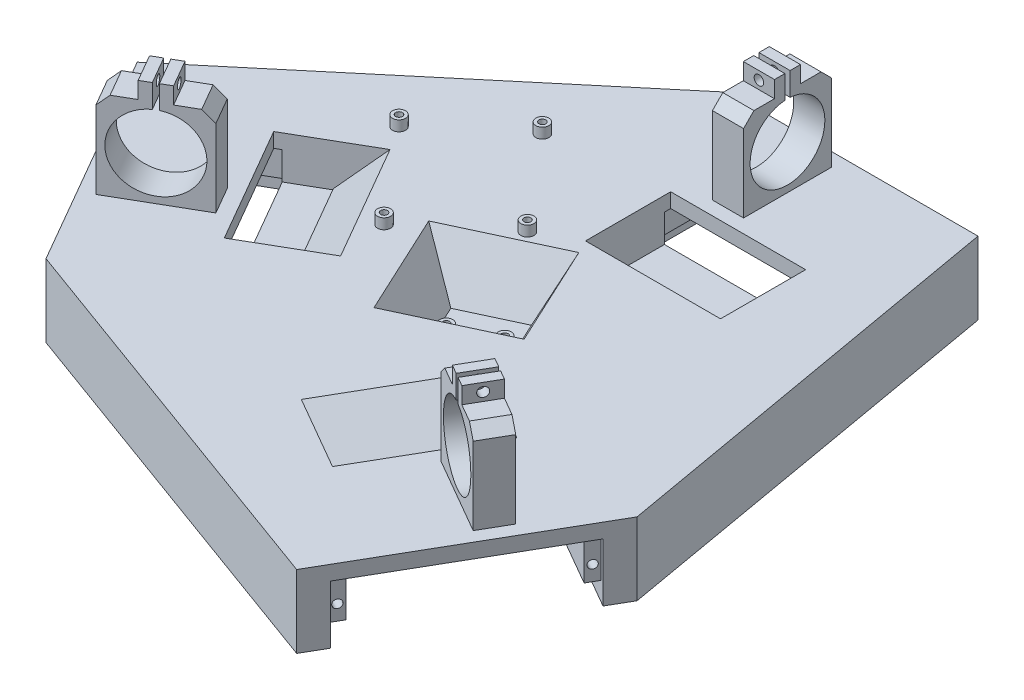
from build123d import *

# Parameters (mm, degrees)
BOSS_EXTRUDE1_DEPTH                     = 35
SKETCH2_W                               = 96
SKETCH2_H                               = 28
CUT_EXTRUDE1_DEPTH                      = 2.5
SKETCH3_W                               = 42
SKETCH3_H                               = 19
CUT_EXTRUDE2_DEPTH                      = 56
SKETCH4_R                               = 2
CUT_EXTRUDE3_DEPTH                      = 6
CUT_EXTRUDE4_START                      = -18
SKETCH5_W                               = 65
SKETCH5_H                               = 22
CUT_EXTRUDE4_DEPTH                      = 21
CHAMFER2_SIZE                           = 20
BOSS_EXTRUDE4_DEPTH                     = 15
CUT_EXTRUDE5_REACH                      = 344.352
SKETCH10_R                              = 2.3
MOTOR_DRIVER_PATTERNED_COUNT            = 3
CHAMFER2_OF_MOTOR_DRIVER_PATTERNED_SIZE = 20
CUT_EXTRUDE6_DEPTH                      = 25
CUT_EXTRUDE6_DRAFT                      = -26.75
SKETCH11_R                              = 3.15
SKETCH11_R_2                            = 1.65
RASPBERRYPI5_STANDOFF_DEPTH             = 5
SKETCH13_R                              = 3.15
SKETCH13_R_2                            = 1.65
BOSS_EXTRUDE6_DEPTH                     = 5


with BuildPart() as part:
    # Sketch1 → Boss-Extrude1 (new body)
    with BuildSketch(Plane(origin=(0, 0, 0), x_dir=(1, 0, 0), z_dir=(0, 1, 0))):
        Polygon((-20, 144.337567297), (100, 144.337567297), (135, -54.848275573), (75, -158.771324027), (-115, -89.489291724), (-175, 14.43375673), align=None)
    extrude(amount=BOSS_EXTRUDE1_DEPTH)

    # Sketch2 → Cut-Extrude1 (cut)
    with BuildSketch(Plane(origin=(0, 0, -144.337567297), x_dir=(-1, 0, 0), z_dir=(0, 0, -1))):
        with Locations((-40, 14)):
            Rectangle(SKETCH2_W, SKETCH2_H)
    cut_extrude1 = extrude(amount=-CUT_EXTRUDE1_DEPTH, mode=Mode.SUBTRACT)

    # Sketch3 → Cut-Extrude2 (cut)
    with BuildSketch(Plane(origin=(0, 0, -141.837567297), x_dir=(-1, 0, 0), z_dir=(0, 0, -1))):
        with Locations((-61, 18.5)):
            Rectangle(SKETCH3_W, SKETCH3_H)
        with Locations((-19, 18.5)):
            Rectangle(SKETCH3_W, SKETCH3_H)
        Polygon((-88, 9), (-88, 0), (8, 0), (8, 9), (2, 9), (-40, 9), (-82, 9), align=None)
    cut_extrude2 = extrude(amount=-CUT_EXTRUDE2_DEPTH, mode=Mode.SUBTRACT)

    # Sketch4 → Cut-Extrude3 (cut)
    with BuildSketch(Plane(origin=(0, 0, -141.837567297), x_dir=(-1, 0, 0), z_dir=(0, 0, -1))):
        with Locations((-85, 16.25)):
            Circle(SKETCH4_R)
        with Locations((5, 16.25)):
            Circle(SKETCH4_R)
    cut_extrude3 = extrude(amount=-CUT_EXTRUDE3_DEPTH, mode=Mode.SUBTRACT)

    # Sketch5 → Cut-Extrude4 (cut)
    with BuildSketch(Plane(origin=(0, 0, -85.837567297), x_dir=(-1, 0, 0), z_dir=(0, 0, -1)).offset(CUT_EXTRUDE4_START)):
        with Locations((-40, 25.5)):
            Rectangle(SKETCH5_W, SKETCH5_H)
    cut_extrude4 = extrude(amount=CUT_EXTRUDE4_DEPTH, mode=Mode.SUBTRACT)

    # Chamfer2
    chamfer2_edges = [part.edges().sort_by_distance(p)[0] for p in [
        (40, 35, -67.837567297),
    ]]
    chamfer(chamfer2_edges, length=CHAMFER2_SIZE)

    # Sketch7 → Boss-Extrude4 (add)
    with BuildSketch(Plane(origin=(36, 0, 0), x_dir=(0, 0, -1), z_dir=(1, 0, 0))):
        with BuildLine():
            Line((95.437567297, 72.3), (95.437567297, 35))
            Line((95.437567297, 35), (137.737567297, 35))
            Line((137.737567297, 35), (137.737567297, 72.3))
            Line((137.737567297, 72.3), (132.737567297, 77.3))
            Line((132.737567297, 77.3), (122.837567297, 77.3))
            Line((122.837567297, 77.3), (122.837567297, 85.3))
            Line((122.837567297, 85.3), (117.837567297, 85.3))
            Line((117.837567297, 85.3), (117.837567297, 74.106544768))
            ThreePointArc((117.837567297, 74.106544768), (116.587567297, 38.15), (115.337567297, 74.106544768))
            Line((115.337567297, 74.106544768), (115.337567297, 85.3))
            Line((115.337567297, 85.3), (110.337567297, 85.3))
            Line((110.337567297, 85.3), (110.337567297, 77.3))
            Line((110.337567297, 77.3), (100.437567297, 77.3))
            Line((100.437567297, 77.3), (95.437567297, 72.3))
        make_face()
    boss_extrude4 = extrude(amount=-BOSS_EXTRUDE4_DEPTH)

    # Cut-Extrude5: up to this face of the body (flat: up to its plane)
    cut_extrude5_end = Plane(part.part.faces().sort_by_distance((28.5, 81.3, -110.337567297))[0])
    # Sketch10 → Cut-Extrude5 (cut, up to the picked face)
    with BuildSketch(Plane(origin=(0, 0, -122.837567297), x_dir=(-1, 0, 0), z_dir=(0, 0, -1)), mode=Mode.PRIVATE) as cut_extrude5_sk1:
        with Locations(Location((-28.5, 81.3, 0), (0, 0, 90))):
            Circle(SKETCH10_R)
    cut_extrude5_tool1 = split(extrude(cut_extrude5_sk1.sketch, amount=-CUT_EXTRUDE5_REACH, mode=Mode.PRIVATE), bisect_by=cut_extrude5_end, keep=Keep.BOTH, mode=Mode.PRIVATE)
    cut_extrude5 = cut_extrude5_tool1.solids().sort_by(Axis((28.5, 81.3, -122.837567), (0, 0, 1)))[0]
    add(cut_extrude5, mode=Mode.SUBTRACT)

    # Motor/Driver Patterned: Cut-Extrude1, Cut-Extrude2, Cut-Extrude3, Cut-Extrude4, Boss-Extrude4, Cut-Extrude5 ×3 about axis
    motor_driver_patterned_axis = Axis((0, 0, 0), (0, 1, 0))
    add([cut_extrude1.rotate(motor_driver_patterned_axis, i * 360 / MOTOR_DRIVER_PATTERNED_COUNT) for i in range(1, MOTOR_DRIVER_PATTERNED_COUNT)], mode=Mode.SUBTRACT)
    add([cut_extrude2.rotate(motor_driver_patterned_axis, i * 360 / MOTOR_DRIVER_PATTERNED_COUNT) for i in range(1, MOTOR_DRIVER_PATTERNED_COUNT)], mode=Mode.SUBTRACT)
    add([cut_extrude3.rotate(motor_driver_patterned_axis, i * 360 / MOTOR_DRIVER_PATTERNED_COUNT) for i in range(1, MOTOR_DRIVER_PATTERNED_COUNT)], mode=Mode.SUBTRACT)
    add([cut_extrude4.rotate(motor_driver_patterned_axis, i * 360 / MOTOR_DRIVER_PATTERNED_COUNT) for i in range(1, MOTOR_DRIVER_PATTERNED_COUNT)], mode=Mode.SUBTRACT)
    add([boss_extrude4.rotate(motor_driver_patterned_axis, i * 360 / MOTOR_DRIVER_PATTERNED_COUNT) for i in range(1, MOTOR_DRIVER_PATTERNED_COUNT)])
    add([cut_extrude5.rotate(motor_driver_patterned_axis, i * 360 / MOTOR_DRIVER_PATTERNED_COUNT) for i in range(1, MOTOR_DRIVER_PATTERNED_COUNT)], mode=Mode.SUBTRACT)

    # Chamfer2 of Motor/Driver Patterned
    chamfer2_of_motor_driver_patterned_edges = [part.edges().sort_by_distance(p)[0] for p in [
        (-78.74905661, 35, -0.722232503),
        (38.74905661, 35, 68.5597998),
    ]]
    chamfer(chamfer2_of_motor_driver_patterned_edges, length=CHAMFER2_OF_MOTOR_DRIVER_PATTERNED_SIZE)


with BuildPart() as cut_extrude6_tool:
    # Sketch16 → Cut-Extrude6 (with draft: the straight prism first)
    with BuildSketch(Plane(origin=(0, 10, 0), x_dir=(1, 0, 0), z_dir=(0, 1, 0))):
        Polygon((4.64219366, 24.61990329), (-21.829310641, 12.295153393), (-9.504560743, -14.176350908), (16.966943558, -1.851601011), align=None)
    extrude(amount=CUT_EXTRUDE6_DEPTH)
    # Cut-Extrude6: the draft: its side faces are tilted about the plane it starts from
    cut_extrude6_sides = [cut_extrude6_tool.faces().sort_by_distance(p)[0] for p in [
        (-8.59355849, 22.5, -18.457528341),
        (-15.666935692, 22.5, 0.940598758),
        (3.731191407, 22.5, 8.01397596),
        (10.804568609, 22.5, -11.38415114),
    ]]
    draft(cut_extrude6_sides, Plane(origin=(0, 10, 0), x_dir=(1, 0, 0), z_dir=(0, 1, 0)), CUT_EXTRUDE6_DRAFT)


with BuildPart() as part_1:
    add(part.part)

    # Cut-Extrude6: cut by cut_extrude6_tool
    add(cut_extrude6_tool.part, mode=Mode.SUBTRACT)

    # Sketch11 → RaspberryPi5 Standoff (add)
    # profile 1 of 4: a face of its own
    with BuildSketch(Plane(origin=(0, 35, 0), x_dir=(1, 0, 0), z_dir=(0, 1, 0))):
        with Locations(Location((-10.300566951, 37.647855731, 0), (0, 0, 270))):
            Circle(SKETCH11_R)
        with Locations(Location((-10.300566951, 37.647855731, 0), (0, 0, 270))):
            Circle(SKETCH11_R_2, mode=Mode.SUBTRACT)
    # profile 2 of 4: a face of its own
    with BuildSketch(Plane(origin=(0, 35, 0), x_dir=(1, 0, 0), z_dir=(0, 1, 0))):
        with Locations(Location((-47.555881138, 82.100544792, 0), (0, 0, 270))):
            Circle(SKETCH11_R)
        with Locations(Location((-47.555881138, 82.100544792, 0), (0, 0, 270))):
            Circle(SKETCH11_R_2, mode=Mode.SUBTRACT)
    # profile 3 of 4: a face of its own
    with BuildSketch(Plane(origin=(0, 35, 0), x_dir=(1, 0, 0), z_dir=(0, 1, 0))):
        with Locations(Location((-85.110739139, 50.626227634, 0), (0, 0, 270))):
            Circle(SKETCH11_R)
        with Locations(Location((-85.110739139, 50.626227634, 0), (0, 0, 270))):
            Circle(SKETCH11_R_2, mode=Mode.SUBTRACT)
    # profile 4 of 4: a face of its own
    with BuildSketch(Plane(origin=(0, 35, 0), x_dir=(1, 0, 0), z_dir=(0, 1, 0))):
        with Locations(Location((-47.855424951, 6.173538573, 0), (0, 0, 270))):
            Circle(SKETCH11_R)
        with Locations(Location((-47.855424951, 6.173538573, 0), (0, 0, 270))):
            Circle(SKETCH11_R_2, mode=Mode.SUBTRACT)
    extrude(amount=RASPBERRYPI5_STANDOFF_DEPTH)

    # Sketch13 → Boss-Extrude6 (add)
    # profile 1 of 4: a face of its own
    with BuildSketch(Plane(origin=(0, 10, 0), x_dir=(1, 0, 0), z_dir=(0, 1, 0))):
        with Locations(Location((7.566649181, 8.861795539, 0), (0, 0, 270))):
            Circle(SKETCH13_R)
        with Locations(Location((7.566649181, 8.861795539, 0), (0, 0, 270))):
            Circle(SKETCH13_R_2, mode=Mode.SUBTRACT)
    # profile 2 of 4: a face of its own
    with BuildSketch(Plane(origin=(0, 10, 0), x_dir=(1, 0, 0), z_dir=(0, 1, 0))):
        with Locations(Location((-11.652388188, -0.086310551, 0), (0, 0, 270))):
            Circle(SKETCH13_R)
        with Locations(Location((-11.652388188, -0.086310551, 0), (0, 0, 270))):
            Circle(SKETCH13_R_2, mode=Mode.SUBTRACT)
    # profile 3 of 4: a face of its own
    with BuildSketch(Plane(origin=(0, 10, 0), x_dir=(1, 0, 0), z_dir=(0, 1, 0))):
        with Locations(Location((-7.566649181, -8.861795539, 0), (0, 0, 270))):
            Circle(SKETCH13_R)
        with Locations(Location((-7.566649181, -8.861795539, 0), (0, 0, 270))):
            Circle(SKETCH13_R_2, mode=Mode.SUBTRACT)
    # profile 4 of 4: a face of its own
    with BuildSketch(Plane(origin=(0, 10, 0), x_dir=(1, 0, 0), z_dir=(0, 1, 0))):
        with Locations(Location((11.652388188, 0.086310551, 0), (0, 0, 270))):
            Circle(SKETCH13_R)
        with Locations(Location((11.652388188, 0.086310551, 0), (0, 0, 270))):
            Circle(SKETCH13_R_2, mode=Mode.SUBTRACT)
    extrude(amount=BOSS_EXTRUDE6_DEPTH)


solid = part_1.part
